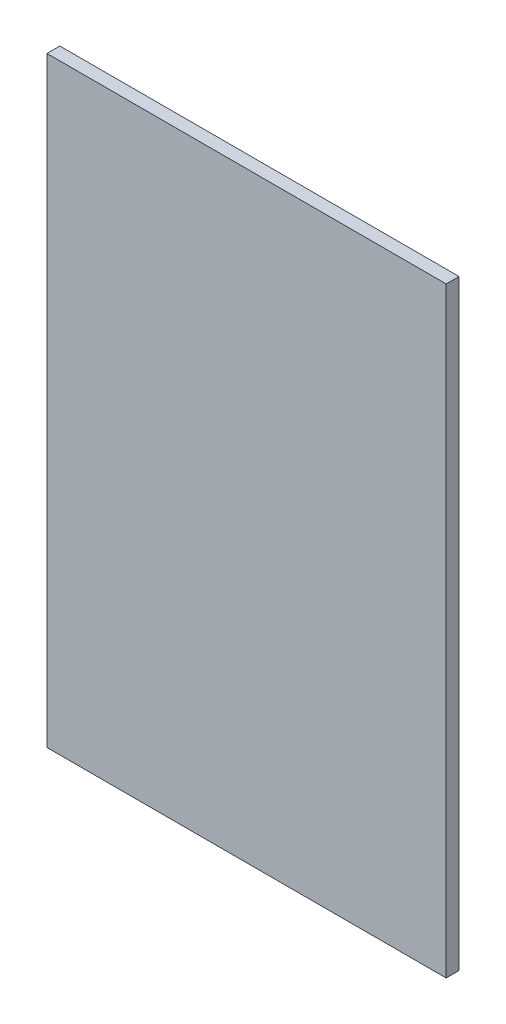
from build123d import *

# Parameters (mm, degrees)
SKETCH1_W           = 123.8
SKETCH1_H           = 186.4
BOSS_EXTRUDE1_DEPTH = 4


with BuildPart() as part:
    # Sketch1 → Boss-Extrude1 (new body)
    with BuildSketch(Plane.XY):
        with Locations((61.9, -93.2)):
            Rectangle(SKETCH1_W, SKETCH1_H)
    extrude(amount=BOSS_EXTRUDE1_DEPTH)


solid = part.part
